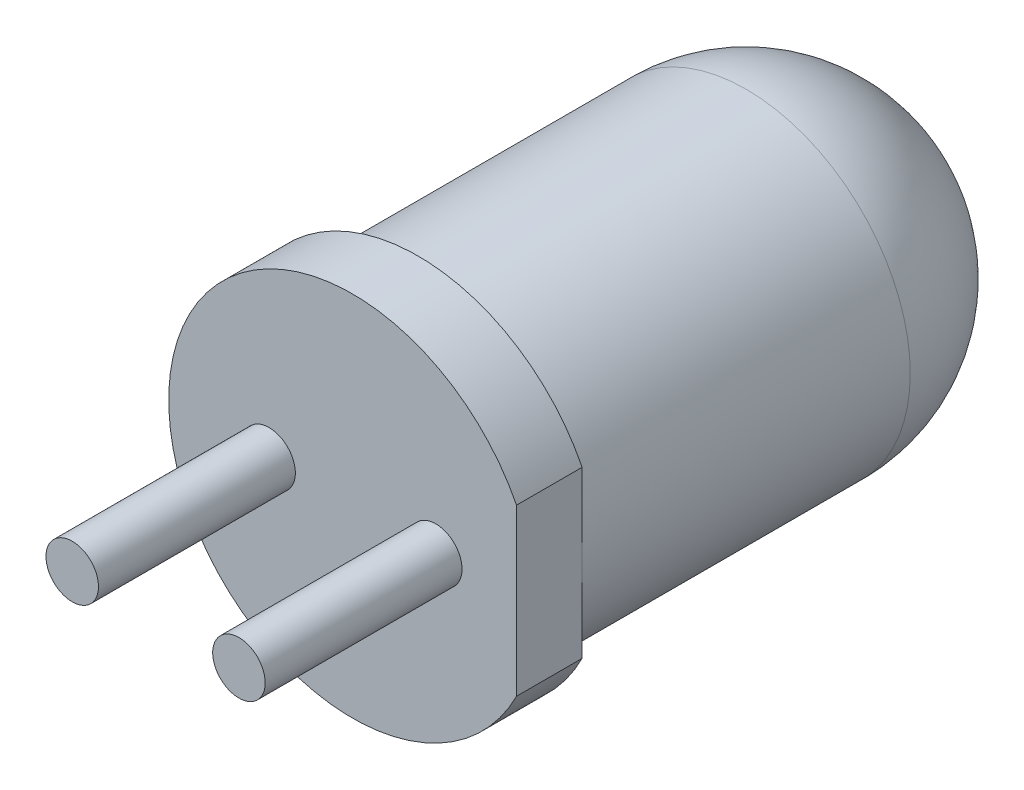
from build123d import *

# Parameters (mm, degrees)
ESQUISSE1_R          = 2.5
BASE_EXTRUSION_DEPTH = 8.5
BOSS_EXTRU_1_DEPTH   = 1
CONG_1_R             = 2.5
ESQUISSE3_R          = 0.4
EXTRUSION1_DEPTH     = 3


with BuildPart() as part:
    # Esquisse1 → Base-Extrusion (new body)
    with BuildSketch(Plane.XY):
        Circle(ESQUISSE1_R)
    extrude(amount=BASE_EXTRUSION_DEPTH)

    # Esquisse2 → Boss.-Extru.1 (add)
    with BuildSketch(Plane.XY.offset(8.5)):
        with BuildLine():
            Line((2.5, 1.260952021), (2.5, -1.260952021))
            ThreePointArc((2.5, -1.260952021), (-2.8, 0), (2.5, 1.260952021))
        make_face()
    extrude(amount=-BOSS_EXTRU_1_DEPTH)

    # Congé1
    cong_1_edges = [part.edges().sort_by_distance(p)[0] for p in [
        (-2.5, 0, 0),
    ]]
    fillet(cong_1_edges, radius=CONG_1_R)

    # Esquisse3 → Extrusion1 (add)
    with BuildSketch(Plane.XY.offset(8.5)):
        with Locations((1.27, 0)):
            Circle(ESQUISSE3_R)
        with Locations(Location((-1.27, 0, 0), (0, 0, 180))):
            Circle(ESQUISSE3_R)
    extrude(amount=EXTRUSION1_DEPTH)


solid = part.part
